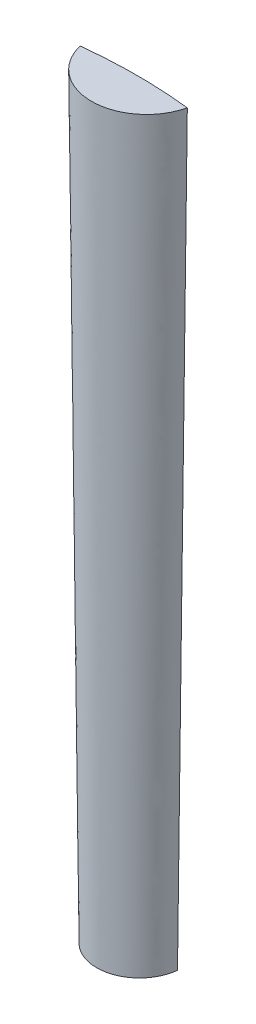
from build123d import *


with BuildPart() as part:
    # Sketch4 for Loft1 → Loft1 section 0
    with BuildSketch(Plane(origin=(0, 413.03, 0), x_dir=(1, 0, 0), z_dir=(0, 1, 0))):
        with BuildLine():
            # circular arc as an exact rational Bezier (weights 1, cos(half-angle), 1)
            Bezier((3.411173818, -1.486067363), (30.150054, 1.495276154), (56.888934182, -1.486067363), weights=[1, 0.993841412, 1])
            Bezier((56.888934182, -1.486067363), (30.150054, -113.662589607), (3.411173818, -1.486067363), weights=[1, 0.231868224, 1])
        make_face()
    # Sketch2 for Loft1 → Loft1 section 1
    with BuildSketch(Plane(origin=(0, 37.07, 0), x_dir=(1, 0, 0), z_dir=(0, 1, 0))):
        with BuildLine():
            Bezier((51.441561571, -0.941181345), (30.150054, 0.944866761), (8.858546429, -0.941181345), weights=[1, 0.996099539, 1])
            Bezier((8.858546429, -0.941181345), (30.150054, -192.779980086), (51.441561571, -0.941181345), weights=[1, 0.110309138, 1])
        make_face()
    loft()


solid = part.part
